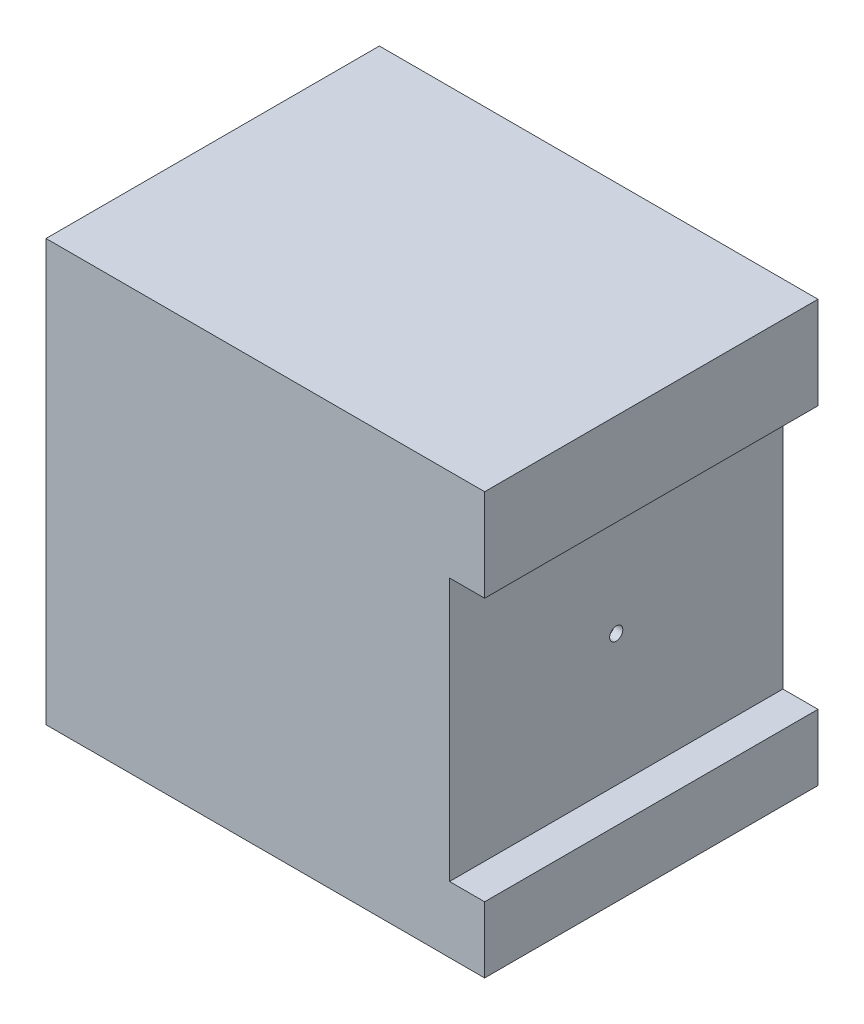
from build123d import *

# Parameters (mm, degrees)
SKETCH1_W           = 50
SKETCH1_H           = 45
BOSS_EXTRUDE1_DEPTH = 4
SKETCH2_W           = 38
SKETCH2_H           = 45.007332522
BOSS_EXTRUDE2_DEPTH = 5
SKETCH3_W           = 50
SKETCH3_H           = 38
BOSS_EXTRUDE3_DEPTH = 3
SKETCH4_W           = 38
SKETCH4_H           = 48.007332522
BOSS_EXTRUDE4_DEPTH = 5
SKETCH5_W           = 38
SKETCH5_H           = 29.964277952
CUT_EXTRUDE3_DEPTH  = 4
SKETCH7_R           = 0.75
CUT_EXTRUDE4_DEPTH  = 54


with BuildPart() as part:
    # Sketch1 → Boss-Extrude1 (new body)
    with BuildSketch(Plane.XY):
        Rectangle(SKETCH1_W, SKETCH1_H)
    extrude(amount=BOSS_EXTRUDE1_DEPTH)

    # Sketch2 → Boss-Extrude2 (add)
    with BuildSketch(Plane(origin=(25, 0, 0), x_dir=(0, 0, -1), z_dir=(1, 0, 0))):
        with Locations((15, -0.003666261)):
            Rectangle(SKETCH2_W, SKETCH2_H)
    extrude(amount=-BOSS_EXTRUDE2_DEPTH)

    # Sketch3 → Boss-Extrude3 (add)
    with BuildSketch(Plane(origin=(0, 22.5, 0), x_dir=(1, 0, 0), z_dir=(0, 1, 0))):
        with Locations((0, 15)):
            Rectangle(SKETCH3_W, SKETCH3_H)
    extrude(amount=BOSS_EXTRUDE3_DEPTH)

    # Sketch4 → Boss-Extrude4 (add)
    with BuildSketch(Plane.ZY.offset(25)):
        with Locations((-15, 1.496333739)):
            Rectangle(SKETCH4_W, SKETCH4_H)
    extrude(amount=-BOSS_EXTRUDE4_DEPTH)

    # Sketch5 → Cut-Extrude3 (cut)
    with BuildSketch(Plane(origin=(25, 0, 0), x_dir=(0, 0, -1), z_dir=(1, 0, 0))):
        with Locations((15, 0)):
            Rectangle(SKETCH5_W, SKETCH5_H)
    extrude(amount=-CUT_EXTRUDE3_DEPTH, mode=Mode.SUBTRACT)

    # Sketch7 → Cut-Extrude4 (cut)
    with BuildSketch(Plane.ZY.offset(25)):
        with Locations(Location((-15, 0, 0), (0, 0, 90))):
            Circle(SKETCH7_R)
    extrude(amount=-CUT_EXTRUDE4_DEPTH, mode=Mode.SUBTRACT)


solid = part.part
